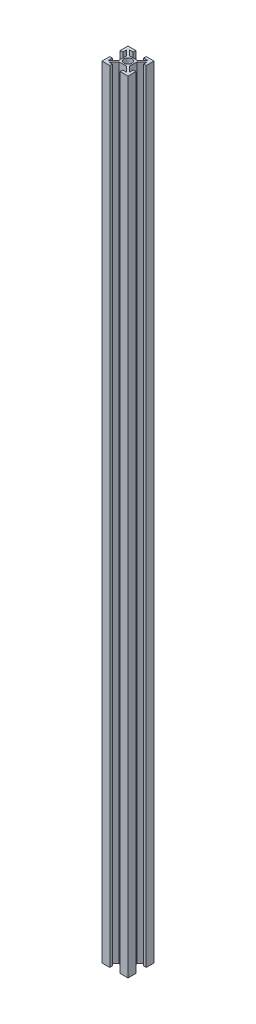
from build123d import *

# Parameters (mm, degrees)
F_2020_SKETCH_R     = 3
BOSS_EXTRUDE1_DEPTH = 600


with BuildPart() as part:
    # 2020 sketch → Boss-Extrude1 (new body)
    with BuildSketch(Plane(origin=(0, 0, 0), x_dir=(1, 0, 0), z_dir=(0, 1, 0))):
        Polygon((-4, 10), (-4, 8), (-7, 8), (-3, 4), (3, 4), (7, 8), (4, 8), (4, 10), (10, 10), (10, 4), (8, 4), (8, 7), (4, 3), (4, -3), (8, -7), (8, -4), (10, -4), (10, -10), (4, -10), (4, -8), (7, -8), (3, -4), (-3, -4), (-7, -8), (-4, -8), (-4, -10), (-10, -10), (-10, -4), (-8, -4), (-8, -7), (-4, -3), (-4, 3), (-8, 7), (-8, 4), (-10, 4), (-10, 10), align=None)
        with Locations(Location((0, 0, 0), (0, 0, 270))):
            Circle(F_2020_SKETCH_R, mode=Mode.SUBTRACT)
    extrude(amount=BOSS_EXTRUDE1_DEPTH)


solid = part.part
